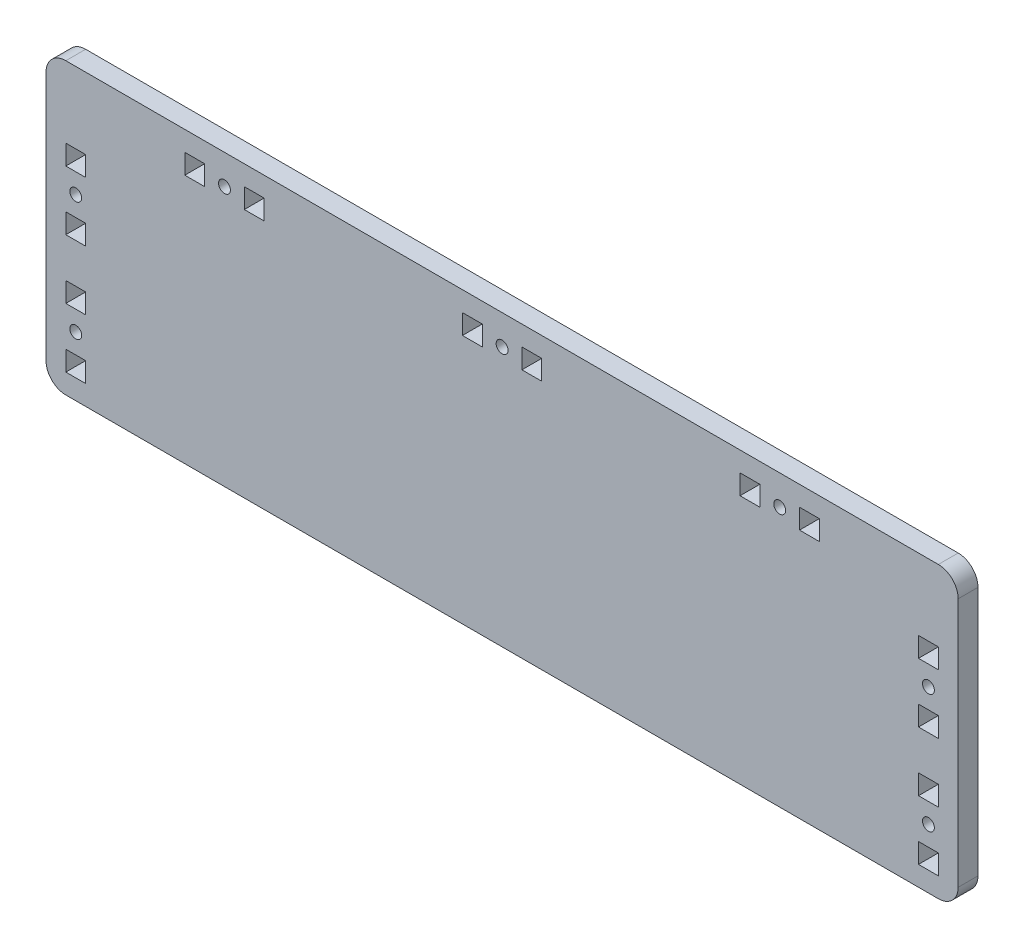
from build123d import *

# Parameters (mm, degrees)
ESQUISSE1_W        = 230
ESQUISSE1_H        = 73
ESQUISSE1_R        = 1.5
ESQUISSE1_W_2      = 5
ESQUISSE1_H_2      = 5
BOSS_EXTRU_1_DEPTH = 5
CONG_1_R           = 5


with BuildPart() as part:
    # Esquisse1 → Boss.-Extru.1 (new body)
    with BuildSketch(Plane.XY):
        with Locations((0, 36.5)):
            Rectangle(ESQUISSE1_W, ESQUISSE1_H)
        with Locations((107.5, 45)):
            Circle(ESQUISSE1_R, mode=Mode.SUBTRACT)
        with Locations((107.5, 15)):
            Circle(ESQUISSE1_R, mode=Mode.SUBTRACT)
        with Locations(Location((-107.5, 15, 0), (0, 0, 180))):
            Circle(ESQUISSE1_R, mode=Mode.SUBTRACT)
        with Locations(Location((-107.5, 45, 0), (0, 0, 180))):
            Circle(ESQUISSE1_R, mode=Mode.SUBTRACT)
        with Locations(Location((0, 65.5, 0), (0, 0, 90))):
            Circle(ESQUISSE1_R, mode=Mode.SUBTRACT)
        with Locations(Location((70, 65.5, 0), (0, 0, 90))):
            Circle(ESQUISSE1_R, mode=Mode.SUBTRACT)
        with Locations((-70, 65.5)):
            Circle(ESQUISSE1_R, mode=Mode.SUBTRACT)
        with Locations((107.5, 37.5)):
            Rectangle(ESQUISSE1_W_2, ESQUISSE1_H_2, mode=Mode.SUBTRACT)
        with Locations((107.5, 52.5)):
            Rectangle(ESQUISSE1_W_2, ESQUISSE1_H_2, mode=Mode.SUBTRACT)
        with Locations((107.5, 7.5)):
            Rectangle(ESQUISSE1_W_2, ESQUISSE1_H_2, mode=Mode.SUBTRACT)
        with Locations((107.5, 22.5)):
            Rectangle(ESQUISSE1_W_2, ESQUISSE1_H_2, mode=Mode.SUBTRACT)
        with Locations((-107.5, 7.5)):
            Rectangle(ESQUISSE1_W_2, ESQUISSE1_H_2, mode=Mode.SUBTRACT)
        with Locations((-107.5, 22.5)):
            Rectangle(ESQUISSE1_W_2, ESQUISSE1_H_2, mode=Mode.SUBTRACT)
        with Locations((-107.5, 37.5)):
            Rectangle(ESQUISSE1_W_2, ESQUISSE1_H_2, mode=Mode.SUBTRACT)
        with Locations((-107.5, 52.5)):
            Rectangle(ESQUISSE1_W_2, ESQUISSE1_H_2, mode=Mode.SUBTRACT)
        with Locations((7.5, 65.5)):
            Rectangle(ESQUISSE1_W_2, ESQUISSE1_H_2, mode=Mode.SUBTRACT)
        with Locations((-7.5, 65.5)):
            Rectangle(ESQUISSE1_W_2, ESQUISSE1_H_2, mode=Mode.SUBTRACT)
        with Locations((77.5, 65.5)):
            Rectangle(ESQUISSE1_W_2, ESQUISSE1_H_2, mode=Mode.SUBTRACT)
        with Locations((62.5, 65.5)):
            Rectangle(ESQUISSE1_W_2, ESQUISSE1_H_2, mode=Mode.SUBTRACT)
        with Locations((-77.5, 65.5)):
            Rectangle(ESQUISSE1_W_2, ESQUISSE1_H_2, mode=Mode.SUBTRACT)
        with Locations((-62.5, 65.5)):
            Rectangle(ESQUISSE1_W_2, ESQUISSE1_H_2, mode=Mode.SUBTRACT)
    extrude(amount=BOSS_EXTRU_1_DEPTH)

    # Congé1
    cong_1_edges = [part.edges().sort_by_distance(p)[0] for p in [
        (-115, 73, 2.5),
        (115, 73, 2.5),
        (115, 0, 2.5),
        (-115, 0, 2.5),
    ]]
    fillet(cong_1_edges, radius=CONG_1_R)


solid = part.part
